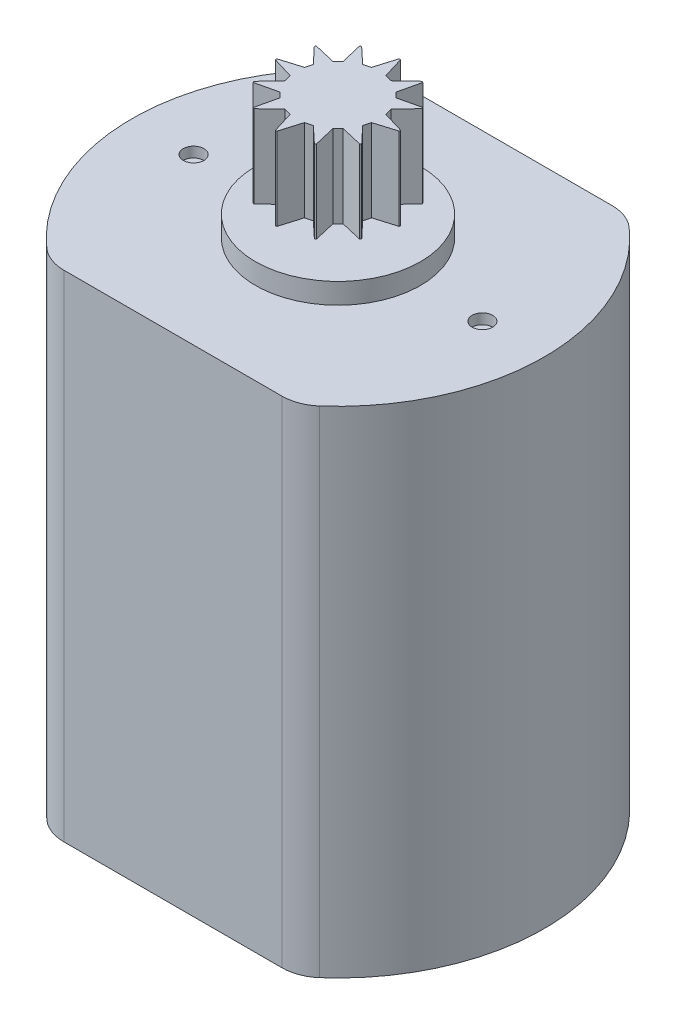
from build123d import *

# Parameters (mm, degrees)
BOSS_EXTRUDE1_DEPTH = 12
SKETCH3_R           = 2
BOSS_EXTRUDE2_DEPTH = 1
FILLET3_R           = 1
BOSS_EXTRUDE3_START = 0.5
SKETCH4_R           = 2
BOSS_EXTRUDE3_DEPTH = 0.5
SKETCH5_R           = 0.25
CUT_EXTRUDE1_DEPTH  = 0.25
SKETCH6_R           = 0.25
BOSS_EXTRUDE4_DEPTH = 2.5
SKETCH7_R           = 1.5
BOSS_EXTRUDE5_DEPTH = 2
CUT_EXTRUDE11_DEPTH = 2
CIRPATTERN2_COUNT   = 12


with BuildPart() as part:
    # Sketch2 → Boss-Extrude1 (new body)
    with BuildSketch(Plane(origin=(0, 0, 0), x_dir=(1, 0, 0), z_dir=(0, 1, 0))):
        with BuildLine():
            Line((-3, 4), (3, 4))
            ThreePointArc((3, 4), (5, 0), (3, -4))
            Line((3, -4), (-3, -4))
            ThreePointArc((-3, -4), (-5, 0), (-3, 4))
        make_face()
    extrude(amount=BOSS_EXTRUDE1_DEPTH)

    # Sketch3 → Boss-Extrude2 (add)
    with BuildSketch(Plane(origin=(0, 0, 0), x_dir=(-1, 0, 0), z_dir=(0, -1, 0))):
        with Locations(Location((0, 0, 0), (0, 0, 90))):
            Circle(SKETCH3_R)
    extrude(amount=BOSS_EXTRUDE2_DEPTH)

    # Fillet3
    fillet3_edges = [part.edges().sort_by_distance(p)[0] for p in [
        (-3, 6, -4),
        (3, 6, -4),
        (3, 6, 4),
        (-3, 6, 4),
    ]]
    fillet(fillet3_edges, radius=FILLET3_R)

    # Sketch4 → Boss-Extrude3 (add)
    with BuildSketch(Plane(origin=(0, 12, 0), x_dir=(1, 0, 0), z_dir=(0, 1, 0)).offset(BOSS_EXTRUDE3_START)):
        with Locations(Location((0, 0, 0), (0, 0, 90))):
            Circle(SKETCH4_R)
    extrude(amount=-BOSS_EXTRUDE3_DEPTH)

    # Sketch5 → Cut-Extrude1 (cut)
    with BuildSketch(Plane(origin=(0, 12, 0), x_dir=(1, 0, 0), z_dir=(0, 1, 0))):
        with Locations(Location((3.5, 0, 0), (0, 0, 270))):
            Circle(SKETCH5_R)
    cut_extrude1 = extrude(amount=-CUT_EXTRUDE1_DEPTH, mode=Mode.SUBTRACT)

    # Mirror1: Cut-Extrude1 across plane
    add(cut_extrude1.mirror(Plane(origin=(0, 0, 0), x_dir=(0, 0, 1), z_dir=(1, 0, 0))), mode=Mode.SUBTRACT)

    # Sketch6 → Boss-Extrude4 (add)
    with BuildSketch(Plane(origin=(0, 12.5, 0), x_dir=(1, 0, 0), z_dir=(0, 1, 0))):
        with Locations(Location((0, 0, 0), (0, 0, 270))):
            Circle(SKETCH6_R)
    extrude(amount=BOSS_EXTRUDE4_DEPTH)

    # Sketch7 → Boss-Extrude5 (add)
    with BuildSketch(Plane(origin=(0, 15, 0), x_dir=(1, 0, 0), z_dir=(0, 1, 0))):
        with Locations(Location((0, 0, 0), (0, 0, 270))):
            Circle(SKETCH7_R)
    extrude(amount=-BOSS_EXTRUDE5_DEPTH)

    # Sketch9 → Cut-Extrude11 (cut)
    with BuildSketch(Plane(origin=(0, 15, 0), x_dir=(1, 0, 0), z_dir=(0, 1, 0))):
        Polygon((-0.342020143, -0.939692621), (-0.173648178, -0.984807753), (0, -1.556082509), (-0.781544676, -1.353675088), align=None)
    cut_extrude11 = extrude(amount=-CUT_EXTRUDE11_DEPTH, mode=Mode.SUBTRACT)

    # CirPattern2: Cut-Extrude11 ×12 about axis
    cirpattern2_axis = Axis((0, 0, 0), (0, 1, 0))
    for i in range(1, CIRPATTERN2_COUNT):
        add(cut_extrude11.rotate(cirpattern2_axis, i * 360 / CIRPATTERN2_COUNT), mode=Mode.SUBTRACT)


solid = part.part
